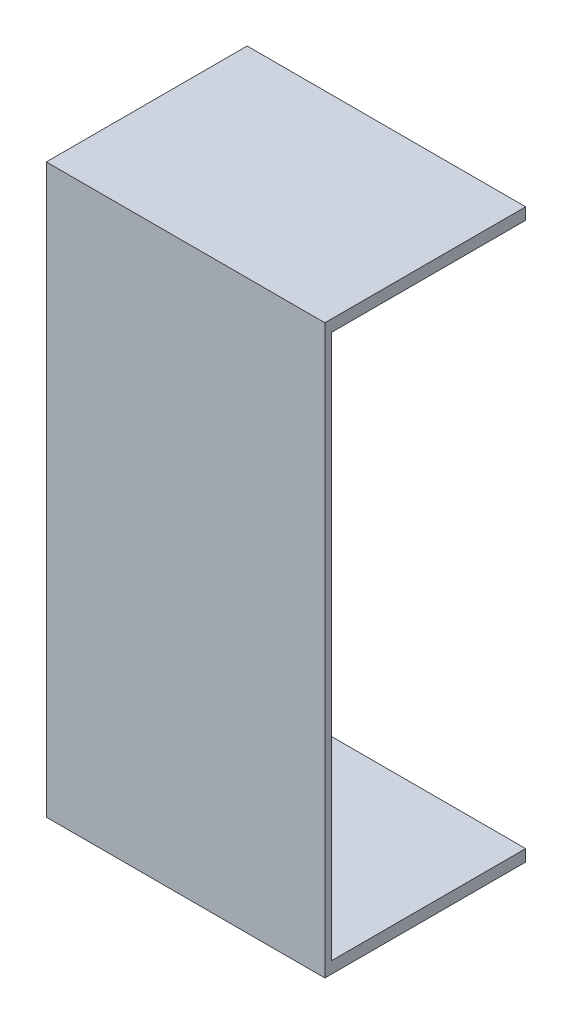
from build123d import *

# Parameters (mm, degrees)
BOSS_EXTRUDE1_DEPTH = 43


with BuildPart() as part:
    # Sketch1 → Boss-Extrude1 (new body)
    with BuildSketch(Plane(origin=(-174, 0, 0), x_dir=(0, 0, -1), z_dir=(1, 0, 0))):
        Polygon((-44, 88.8), (-13, 88.8), (-13, 87), (-43, 87), (-43, 3), (-13, 3), (-13, 1.2), (-44, 1.2), align=None)
    extrude(amount=BOSS_EXTRUDE1_DEPTH)


solid = part.part
